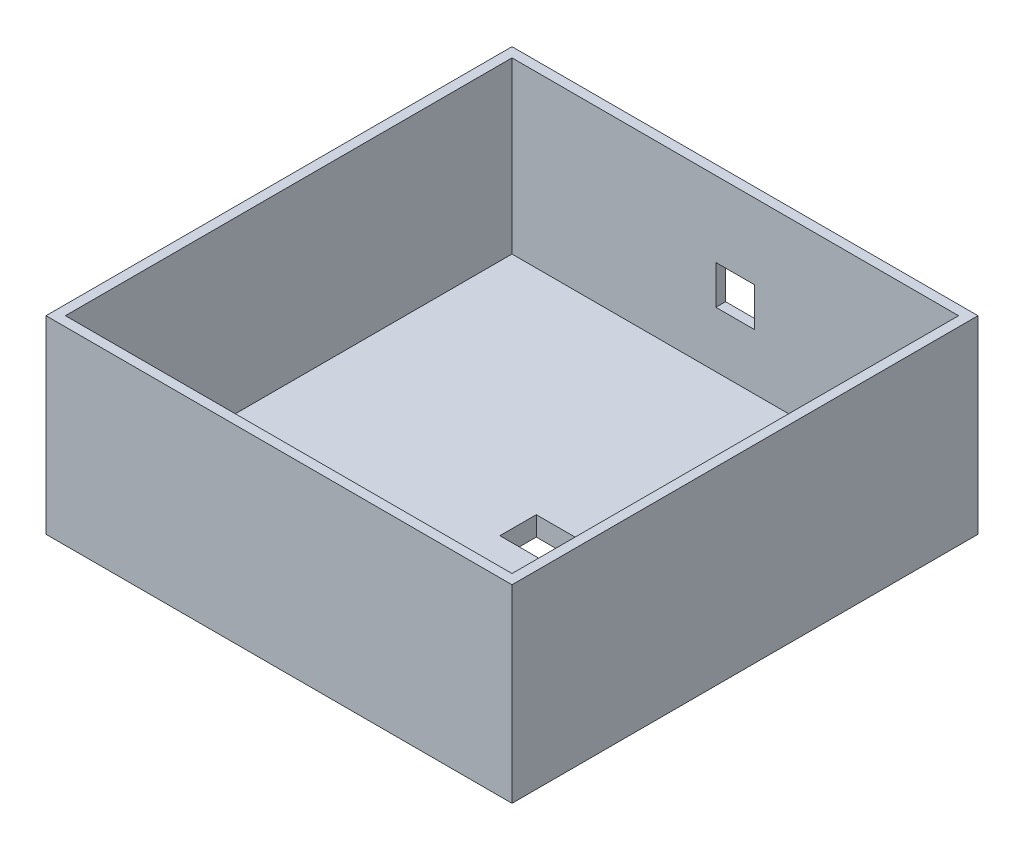
from build123d import *

# Parameters (mm, degrees)
SKETCH1_W               = 100
SKETCH1_H               = 100
BOSS_EXTRUDE1_DEPTH     = 4
SKETCH2_W               = 100
SKETCH2_H               = 100
SKETCH2_W_2             = 92
SKETCH2_H_2             = 92
BOSS_EXTRUDE2_DEPTH     = 35
SKETCH3_W               = 4
SKETCH3_H               = 4
CUT_EXTRUDE1_DEPTH      = 4
BOSS_EXTRUDE3_DEPTH     = 2.5
SKETCH5_W               = 5.75
SKETCH5_H               = 4
CUT_EXTRUDE2_DEPTH      = 4
CUT_EXTRUDE3_DEPTH      = 79.89866919
CUT_EXTRUDE3_DEPTH_BACK = 79.89866919
SKETCH7_W               = 9.25
SKETCH7_H               = 7.5
SKETCH8_W               = 6.199178059
SKETCH8_H               = 6.70376232
SKETCH8_W_2             = 7.56876391
SKETCH8_H_2             = 7.20834658
CUT_EXTRUDE5_DEPTH      = 10
SKETCH9_W               = 12
SKETCH9_H               = 8
CUT_EXTRUDE6_DEPTH      = 10
SKETCH10_W              = 4
SKETCH10_H              = 4
BOSS_EXTRUDE4_DEPTH     = 4
SKETCH11_OUTSIDE_W      = 131.34
SKETCH11_OUTSIDE_H      = 131.34
SKETCH11_OUTSIDE_W_2    = 96
SKETCH11_OUTSIDE_H_2    = 96
CUT_EXTRUDE7_DEPTH      = 81.752708933
SKETCH12_W              = 2
SKETCH12_H              = 8
BOSS_EXTRUDE5_DEPTH     = 2


with BuildPart() as part:
    # Sketch1 → Boss-Extrude1 (new body)
    with BuildSketch(Plane(origin=(0, 0, 0), x_dir=(1, 0, 0), z_dir=(0, 1, 0))):
        Rectangle(SKETCH1_W, SKETCH1_H)
    extrude(amount=BOSS_EXTRUDE1_DEPTH)

    # Sketch2 → Boss-Extrude2 (add)
    with BuildSketch(Plane(origin=(0, 4, 0), x_dir=(1, 0, 0), z_dir=(0, 1, 0))):
        Rectangle(SKETCH2_W, SKETCH2_H)
        Rectangle(SKETCH2_W_2, SKETCH2_H_2, mode=Mode.SUBTRACT)
    extrude(amount=BOSS_EXTRUDE2_DEPTH)

    # Sketch3 → Cut-Extrude1 (cut)
    with BuildSketch(Plane(origin=(0, 0, -50), x_dir=(-1, 0, 0), z_dir=(0, 0, -1))):
        with Locations((0, 37)):
            Rectangle(SKETCH3_W, SKETCH3_H)
    extrude(amount=-CUT_EXTRUDE1_DEPTH, mode=Mode.SUBTRACT)

    # Sketch4 → Boss-Extrude3 (add)
    with BuildSketch(Plane(origin=(0, 4, 0), x_dir=(1, 0, 0), z_dir=(0, 1, 0))):
        Polygon((-1.75, -0.5), (0.75, -0.5), (0.75, 2), (-4.25, 2), (-4.25, -3), (-1.75, -3), align=None)
        Polygon((7.25, -0.5), (9.75, -0.5), (9.75, -3), (12.25, -3), (12.25, 2), (7.25, 2), align=None)
        Polygon((12.25, -14.5), (9.75, -14.5), (9.75, -17), (7.25, -17), (7.25, -19.5), (12.25, -19.5), align=None)
        Polygon((-1.75, -17), (-1.75, -14.5), (-4.25, -14.5), (-4.25, -19.5), (0.75, -19.5), (0.75, -17), align=None)
    extrude(amount=BOSS_EXTRUDE3_DEPTH)

    # Sketch5 → Cut-Extrude2 (cut)
    with BuildSketch(Plane(origin=(0, 4, 0), x_dir=(1, 0, 0), z_dir=(0, 1, 0))):
        with Locations((1.125, -15)):
            Rectangle(SKETCH5_W, SKETCH5_H)
    extrude(amount=-CUT_EXTRUDE2_DEPTH, mode=Mode.SUBTRACT)

    # Sketch7 → Cut-Extrude3 (cut, two sides: drawn at the far end of the back side and taken through both)
    with BuildSketch(Plane(origin=(0, 4, 0), x_dir=(1, 0, 0), z_dir=(0, 1, 0)).offset(-CUT_EXTRUDE3_DEPTH_BACK)):
        with Locations((0.375, -15.75)):
            Rectangle(SKETCH7_W, SKETCH7_H)
        with Locations((7.625, -1.75)):
            Rectangle(SKETCH7_W, SKETCH7_H)
    extrude(amount=CUT_EXTRUDE3_DEPTH + CUT_EXTRUDE3_DEPTH_BACK, mode=Mode.SUBTRACT)

    # Sketch8 → Cut-Extrude5 (cut)
    with BuildSketch(Plane(origin=(0, 4, 0), x_dir=(1, 0, 0), z_dir=(0, 1, 0))):
        with Locations((-1.640574957, -0.408162103)):
            Rectangle(SKETCH8_W, SKETCH8_H)
        with Locations((10.072988236, -16.951317505)):
            Rectangle(SKETCH8_W_2, SKETCH8_H_2)
    extrude(amount=CUT_EXTRUDE5_DEPTH, mode=Mode.SUBTRACT)

    # Sketch9 → Cut-Extrude6 (cut)
    with BuildSketch(Plane(origin=(0, 0, -50), x_dir=(-1, 0, 0), z_dir=(0, 0, -1))):
        with Locations((0, 19.5)):
            Rectangle(SKETCH9_W, SKETCH9_H)
    extrude(amount=-CUT_EXTRUDE6_DEPTH, mode=Mode.SUBTRACT)

    # Sketch10 → Boss-Extrude4 (add)
    with BuildSketch(Plane(origin=(0, 0, -50), x_dir=(-1, 0, 0), z_dir=(0, 0, -1))):
        with Locations((0, 37)):
            Rectangle(SKETCH10_W, SKETCH10_H)
    extrude(amount=-BOSS_EXTRUDE4_DEPTH)

    # Sketch11 outside → Cut-Extrude7 (cut, through all)
    with BuildSketch(Plane(origin=(0, 39, 0), x_dir=(1, 0, 0), z_dir=(0, 1, 0))):
        Rectangle(SKETCH11_OUTSIDE_W, SKETCH11_OUTSIDE_H)
        Rectangle(SKETCH11_OUTSIDE_W_2, SKETCH11_OUTSIDE_H_2, mode=Mode.SUBTRACT)
    extrude(amount=-CUT_EXTRUDE7_DEPTH, mode=Mode.SUBTRACT)

    # Sketch12 → Boss-Extrude5 (add)
    with BuildSketch(Plane(origin=(0, 0, -48), x_dir=(-1, 0, 0), z_dir=(0, 0, -1))):
        with Locations((-5, 19.5)):
            Rectangle(SKETCH12_W, SKETCH12_H)
        with Locations((5, 19.5)):
            Rectangle(SKETCH12_W, SKETCH12_H)
    extrude(amount=-BOSS_EXTRUDE5_DEPTH)


solid = part.part
